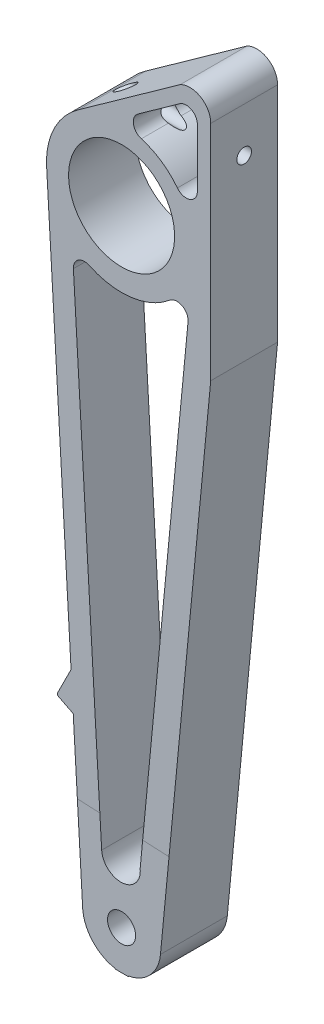
from build123d import *

# Parameters (mm, degrees)
SKETCH1_W           = 50.8
SKETCH1_H           = 248.000519746
SKETCH1_R           = 4.0000047
SKETCH1_R_2         = 15.113
BOSS_EXTRUDE1_DEPTH = 19.05
CUT_EXTRUDE1_REACH  = 137.35
SKETCH3_R           = 2.0828
CUT_EXTRUDE2_REACH  = 130
FILLET2_R           = 3.175
FILLET3_R           = 3.175
CUT_EXTRUDE3_REACH  = 124.668
SKETCH8_R           = 1.500000048
CUT_EXTRUDE4_REACH  = 124.668
SKETCH12_W          = 3.81
SKETCH12_H          = 6.719538638
BOSS_EXTRUDE3_DEPTH = 19.05
SKETCH14_R          = 1.500000048
CUT_EXTRUDE5_DEPTH  = 109.729869862
BOSS_EXTRUDE5_DEPTH = 19.05
FILLET4_R           = 0.635


with BuildPart() as part:
    # Sketch1 → Boss-Extrude1 (new body)
    with BuildSketch(Plane.XY):
        Rectangle(SKETCH1_W, SKETCH1_H)
        with Locations(Location((0, -98.600259873, 0), (0, 0, 180))):
            Circle(SKETCH1_R, mode=Mode.SUBTRACT)
        with Locations(Location((0, 79.550259873, 0), (0, 0, 180))):
            Circle(SKETCH1_R_2, mode=Mode.SUBTRACT)
    extrude(amount=BOSS_EXTRUDE1_DEPTH)

    # Sketch3 → Cut-Extrude1 (cut, up to next)
    with BuildSketch(Plane(origin=(25.4, 0, 0), x_dir=(0, 0, -1), z_dir=(1, 0, 0)), mode=Mode.PRIVATE) as cut_extrude1_sk1:
        with Locations((-9.525, 99.870259873)):
            Circle(SKETCH3_R)
    cut_extrude1_tool1 = extrude(cut_extrude1_sk1.sketch, amount=-CUT_EXTRUDE1_REACH, mode=Mode.PRIVATE) & part.part
    add(cut_extrude1_tool1.solids().sort_by_distance((25.4, 99.87026, 9.525))[0], mode=Mode.SUBTRACT)

    # Sketch4 → Cut-Extrude2 (cut, up to next)
    with BuildSketch(Plane.XY.offset(19.05), mode=Mode.PRIVATE) as cut_extrude2_sk1:
        with BuildLine():
            Line((25.4, -124.000259873), (25.4, 49.070259873))
            Line((25.4, 49.070259873), (11.078372462, -99.666975439))
            ThreePointArc((11.078372462, -99.666975439), (-0.533972701, -109.7170531), (-11.129609989, -98.600259873))
            Line((-11.129609989, -98.600259873), (-21.277335587, 77.084025085))
            ThreePointArc((-21.277335587, 77.084025085), (-21.384145342, 78.315087136), (-21.419788134, 79.550259873))
            ThreePointArc((-21.419788134, 79.550259873), (-19.121183474, 89.203635773), (-12.718706155, 96.785161597))
            ThreePointArc((-12.718706155, 96.785161597), (-12.44619853, 96.982972395), (-12.170614954, 97.176474877))
            Line((-12.170614954, 97.176474877), (16.725657691, 117.807156743))
            Line((16.725657691, 117.807156743), (25.4, 124.000259873))
            Line((25.4, 124.000259873), (-25.4, 124.000259873))
            Line((-25.4, 124.000259873), (-25.4, -124.000259873))
            Line((-25.4, -124.000259873), (25.4, -124.000259873))
        make_face()
    cut_extrude2_tool1 = extrude(cut_extrude2_sk1.sketch, amount=-CUT_EXTRUDE2_REACH, mode=Mode.PRIVATE) & part.part
    # Sketch4 → Cut-Extrude2 (cut, up to next)
    with BuildSketch(Plane.XY.offset(19.05), mode=Mode.PRIVATE) as cut_extrude2_sk2:
        with BuildLine():
            ThreePointArc((16.725657691, 117.807156743), (22.540648101, 117.636552978), (25.4, 112.570259873))
            Line((25.4, 112.570259873), (25.4, 124.000259873))
            Line((25.4, 124.000259873), (16.725657691, 117.807156743))
        make_face()
    cut_extrude2_tool2 = extrude(cut_extrude2_sk2.sketch, amount=-CUT_EXTRUDE2_REACH, mode=Mode.PRIVATE) & part.part
    # Sketch4 → Cut-Extrude2 (cut, up to next)
    with BuildSketch(Plane.XY.offset(19.05), mode=Mode.PRIVATE) as cut_extrude2_sk3:
        with BuildLine():
            ThreePointArc((5.292525145, -81.359808555), (0.293269038, -87.451084718), (-5.679257035, -82.310545911))
            Line((-5.679257035, -82.310545911), (-14.092209721, 63.41901848))
            ThreePointArc((-14.092209721, 63.41901848), (5.243866663, 58.78227523), (20.060972069, 72.042615545))
            Line((20.060972069, 72.042615545), (5.292525145, -81.359808555))
        make_face()
    cut_extrude2_tool3 = extrude(cut_extrude2_sk3.sketch, amount=-CUT_EXTRUDE2_REACH, mode=Mode.PRIVATE) & part.part
    add(cut_extrude2_tool1.solids().sort_by_distance((22.8685, -37.465, 19.05))[0], mode=Mode.SUBTRACT)
    add(cut_extrude2_tool2.solids().sort_by_distance((23.100822, 119.489273, 19.05))[0], mode=Mode.SUBTRACT)
    add(cut_extrude2_tool3.solids().sort_by_distance((1.517355, 0.15341, 19.05))[0], mode=Mode.SUBTRACT)

    # Fillet2
    fillet2_edges = [part.edges().sort_by_distance(p)[0] for p in [
        (-14.092209721, 63.41901848, 9.525),
    ]]
    fillet(fillet2_edges, radius=FILLET2_R)

    # Fillet3
    fillet3_edges = [part.edges().sort_by_distance(p)[0] for p in [
        (20.060972069, 72.042615545, 9.525),
    ]]
    fillet(fillet3_edges, radius=FILLET3_R)

    # Sketch8 → Cut-Extrude3 (cut, up to next)
    with BuildSketch(Plane(origin=(0, 0, 0), x_dir=(1, 0, 0), z_dir=(0, 1, 0)), mode=Mode.PRIVATE) as cut_extrude3_sk1:
        with Locations(Location((0, -9.525, 0), (0, 0, 270))):
            Circle(SKETCH8_R)
    cut_extrude3_tool1 = extrude(cut_extrude3_sk1.sketch, amount=-CUT_EXTRUDE3_REACH, mode=Mode.PRIVATE) & part.part
    add(cut_extrude3_tool1.solids().sort_by_distance((0, 0, 9.525))[0], mode=Mode.SUBTRACT)
    add(cut_extrude3_tool1.solids().sort_by_distance((0, 0, 9.525))[1], mode=Mode.SUBTRACT)

    # Sketch9 → Cut-Extrude4 (cut, up to next)
    with BuildSketch(Plane.XY.offset(19.05), mode=Mode.PRIVATE) as cut_extrude4_sk1:
        with BuildLine():
            Line((21.59, 93.837951404), (21.59, 110.430718326))
            ThreePointArc((21.59, 110.430718326), (19.868129262, 113.2536672), (16.570132064, 113.014724382))
            Line((16.570132064, 113.014724382), (4.664459855, 104.514592245))
            ThreePointArc((4.664459855, 104.514592245), (3.379291217, 101.398142719), (5.622621351, 98.88191817))
            ThreePointArc((5.622621351, 98.88191817), (11.317754993, 96.200644412), (15.90649227, 91.891669316))
            ThreePointArc((15.90649227, 91.891669316), (19.443618723, 90.834192339), (21.59, 93.837951404))
        make_face()
    cut_extrude4_tool1 = extrude(cut_extrude4_sk1.sketch, amount=-CUT_EXTRUDE4_REACH, mode=Mode.PRIVATE) & part.part
    add(cut_extrude4_tool1.solids().sort_by_distance((14.719372, 102.332166, 19.05))[0], mode=Mode.SUBTRACT)

    # Sketch12 → Boss-Extrude3 (add)
    with BuildSketch(Plane.XY.offset(19.05)):
        with Locations((0, -106.370100543)):
            Rectangle(SKETCH12_W, SKETCH12_H)
    extrude(amount=-BOSS_EXTRUDE3_DEPTH)

    # Sketch14 → Cut-Extrude5 (cut)
    with BuildSketch(Plane(origin=(0, 0, 0), x_dir=(1, 0, 0), z_dir=(0, 1, 0))):
        with Locations(Location((0, -9.525, 0), (0, 0, 270))):
            Circle(SKETCH14_R)
    extrude(amount=-CUT_EXTRUDE5_DEPTH, mode=Mode.SUBTRACT)

    # Sketch17 → Boss-Extrude5 (add)
    with BuildSketch(Plane.XY.offset(19.05)):
        Polygon((-14.392423467, -42.112227423), (-13.782717735, -52.66786519), (-18.505869398, -50.292966075), align=None)
    extrude(amount=-BOSS_EXTRUDE5_DEPTH)

    # Fillet4
    fillet4_edges = [part.edges().sort_by_distance(p)[0] for p in [
        (-18.505869398, -50.292966075, 9.525),
    ]]
    fillet(fillet4_edges, radius=FILLET4_R)


solid = part.part
